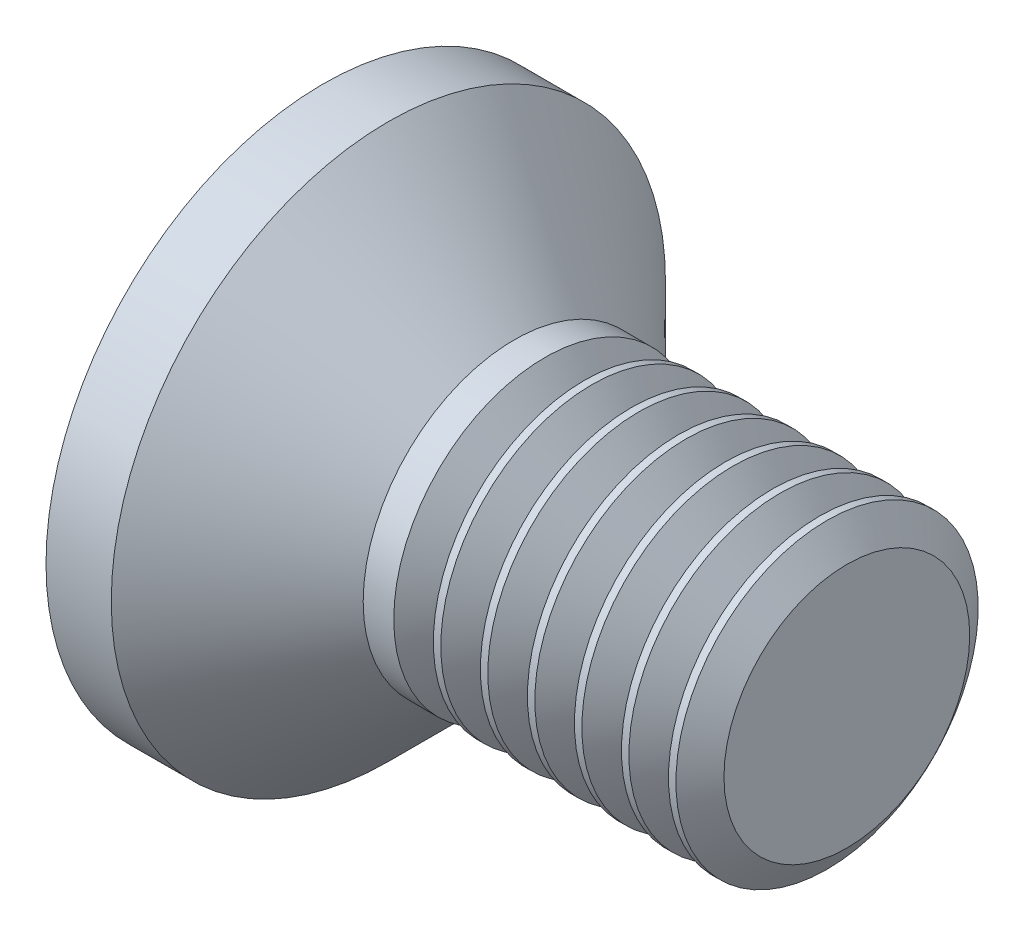
from build123d import *

# Parameters (mm, degrees)
CIRPATTERN1_COUNT = 2
CIRPATTERN1_ANGLE = 90
THDSCHPAT_COUNT   = 7
THDSCHPAT_PITCH   = 0.466666667


with BuildPart() as part:
    # BodySke → Base-Revolve (revolve)
    with BuildSketch(Plane.XY, mode=Mode.PRIVATE) as base_revolve_sk:
        with BuildLine():
            Line((0, 0), (5.727669073, 0))
            Line((5.727669073, 0), (5.727669073, 1.5))
            Line((5.727669073, 1.5), (2.427669073, 1.5))
            Line((2.427669073, 1.5), (1.177669073, 2.75))
            Line((1.177669073, 2.75), (0.529956332, 2.75))
            ThreePointArc((0.529956332, 2.75), (0.133696843, 1.400299407), (0, 0))
        make_face()
    revolve(base_revolve_sk.sketch.rotate(Axis((-15.875, 0, 0), (1, 0, 0)), 90), axis=Axis((-15.875, 0, 0), (1, 0, 0)))

    # Sketch3 → Cross section 0
    with BuildSketch(Plane(origin=(0, 0, 0), x_dir=(0, 0, -1), z_dir=(1, 0, 0))):
        with BuildLine():
            Line((0.415, -1.72), (-0.415, -1.72))
            Line((-0.415, -1.72), (-0.415, 1.72))
            Line((-0.415, 1.72), (0.415, 1.72))
            Line((0.415, 1.72), (0.415, -1.72))
        make_face()
    # Sketch4 → Cross section 1
    with BuildSketch(Plane(origin=(2.33, 0, 0), x_dir=(0, 0, -1), z_dir=(1, 0, 0))):
        with BuildLine():
            Line((0.2075, -0.2075), (-0.2075, -0.2075))
            Line((-0.2075, -0.2075), (-0.2075, 0.2075))
            Line((-0.2075, 0.2075), (0.2075, 0.2075))
            Line((0.2075, 0.2075), (0.2075, -0.2075))
        make_face()
    cross = loft(mode=Mode.SUBTRACT)

    # CirPattern1: Cross ×2 about axis
    cirpattern1_axis = Axis((0, 0, 0), (1, 0, 0))
    for i in range(1, CIRPATTERN1_COUNT):
        add(cross.rotate(cirpattern1_axis, i * CIRPATTERN1_ANGLE / (CIRPATTERN1_COUNT - 1)), mode=Mode.SUBTRACT)

    # ThdSchSke → ThreadSchematic (revolve, cut)
    with BuildSketch(Plane.XY):
        Polygon((2.927669073, -1.2195), (2.731260858, -1.5), (2.731260858, -1.875), (3.124077287, -1.875), (3.124077287, -1.5), align=None)
    threadschematic = revolve(axis=Axis((-3.175, 0, 0), (1, 0, 0)), mode=Mode.SUBTRACT)

    # ThdSchPat: ThreadSchematic ×7
    with Locations(*[(i * THDSCHPAT_PITCH, 0, 0) for i in range(1, THDSCHPAT_COUNT)]):
        add(threadschematic, mode=Mode.SUBTRACT)


solid = part.part
